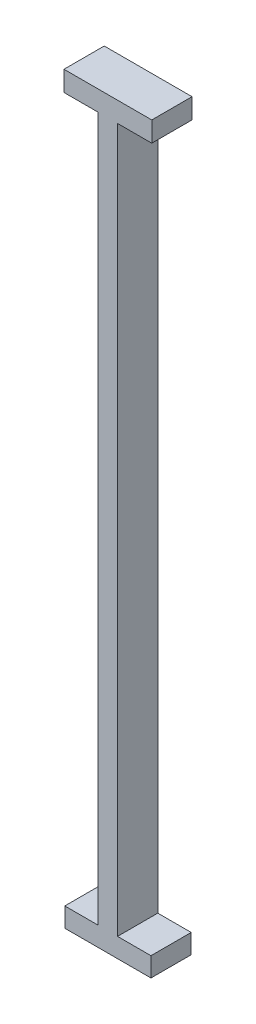
from build123d import *

# Parameters (mm, degrees)
SKETCH1_W           = 4.8
SKETCH1_H           = 2.351445648
SKETCH1_W_2         = 21.4
SKETCH1_H_2         = 4.8
BOSS_EXTRUDE1_DEPTH = 10
SKETCH2_W           = 4.8
SKETCH2_H           = 10
BOSS_EXTRUDE2_DEPTH = 177.5
SKETCH4_W           = 10
SKETCH4_H           = 5
BOSS_EXTRUDE6_DEPTH = 8.5
SKETCH8_W           = 10
SKETCH8_H           = 5
BOSS_EXTRUDE7_DEPTH = 8.5


with BuildPart() as part:
    # Sketch1 → Boss-Extrude1 (new body)
    with BuildSketch(Plane.XY):
        with Locations((-0.408910891, -0.704145163)):
            Rectangle(SKETCH1_W, SKETCH1_H)
        with Locations((-0.408910891, -4.279867987)):
            Rectangle(SKETCH1_W_2, SKETCH1_H_2)
    extrude(amount=BOSS_EXTRUDE1_DEPTH)

    # Sketch2 → Boss-Extrude2 (add)
    with BuildSketch(Plane(origin=(0, 0.471577661, 0), x_dir=(1, 0, 0), z_dir=(0, 1, 0))):
        with Locations((-0.408910891, -5)):
            Rectangle(SKETCH2_W, SKETCH2_H)
    extrude(amount=BOSS_EXTRUDE2_DEPTH)

    # Sketch4 → Boss-Extrude6 (add)
    with BuildSketch(Plane(origin=(1.991089109, 0, 0), x_dir=(0, 0, -1), z_dir=(1, 0, 0))):
        with Locations((-5, 175.471577661)):
            Rectangle(SKETCH4_W, SKETCH4_H)
    extrude(amount=BOSS_EXTRUDE6_DEPTH)

    # Sketch8 → Boss-Extrude7 (add)
    with BuildSketch(Plane.ZY.offset(2.808910891)):
        with Locations((5, 175.471577661)):
            Rectangle(SKETCH8_W, SKETCH8_H)
    extrude(amount=BOSS_EXTRUDE7_DEPTH)


solid = part.part
